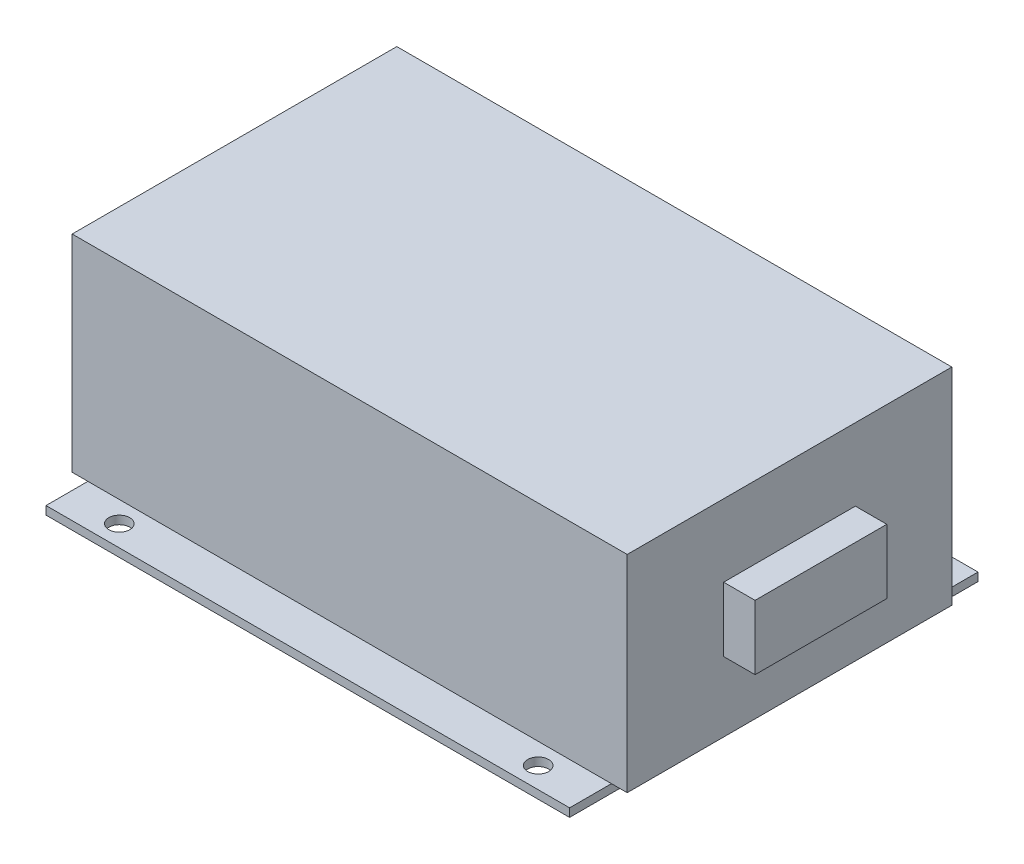
from build123d import *

# Parameters (mm, degrees)
SKETCH1_W           = 100
SKETCH1_H           = 78
SKETCH1_R           = 2
BOSS_EXTRUDE1_DEPTH = 1.5875
SKETCH2_W           = 106
SKETCH2_H           = 62
BOSS_EXTRUDE2_DEPTH = 39.4125
SKETCH3_W           = 25.156810392
SKETCH3_H           = 12.296698836
BOSS_EXTRUDE3_DEPTH = 6


with BuildPart() as part:
    # Sketch1 → Boss-Extrude1 (new body)
    with BuildSketch(Plane(origin=(0, 0, 0), x_dir=(1, 0, 0), z_dir=(0, 1, 0))):
        Rectangle(SKETCH1_W, SKETCH1_H)
        with Locations(Location((-40, 35, 0), (0, 0, 270))):
            Circle(SKETCH1_R, mode=Mode.SUBTRACT)
        with Locations(Location((40, 35, 0), (0, 0, 270))):
            Circle(SKETCH1_R, mode=Mode.SUBTRACT)
        with Locations(Location((-40, -35, 0), (0, 0, 270))):
            Circle(SKETCH1_R, mode=Mode.SUBTRACT)
        with Locations(Location((40, -35, 0), (0, 0, 270))):
            Circle(SKETCH1_R, mode=Mode.SUBTRACT)
    extrude(amount=BOSS_EXTRUDE1_DEPTH)

    # Sketch2 → Boss-Extrude2 (add)
    with BuildSketch(Plane(origin=(0, 1.5875, 0), x_dir=(-1, 0, 0), z_dir=(0, 1, 0))):
        Rectangle(SKETCH2_W, SKETCH2_H)
    extrude(amount=BOSS_EXTRUDE2_DEPTH)

    # Sketch3 → Boss-Extrude3 (add)
    with BuildSketch(Plane(origin=(53, 0, 0), x_dir=(0, 0, -1), z_dir=(1, 0, 0))):
        with Locations((0, 21.048260477)):
            Rectangle(SKETCH3_W, SKETCH3_H)
    extrude(amount=BOSS_EXTRUDE3_DEPTH)


solid = part.part
